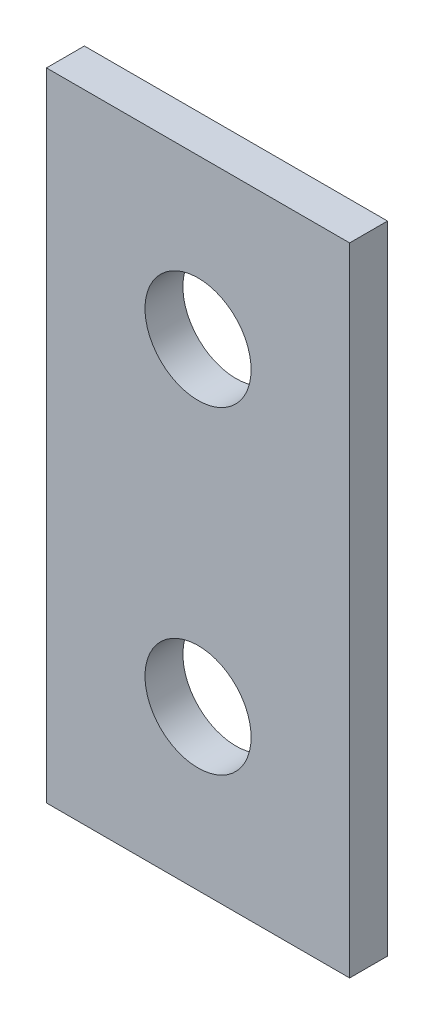
from build123d import *

# Parameters (mm, degrees)
CROQUIS4_W              = 40
CROQUIS4_H              = 84
SALIENTE_EXTRUIR3_DEPTH = 5
CROQUIS5_R              = 7
CORTAR_EXTRUIR1_DEPTH   = 5
CROQUIS5_3_R            = 7
CORTAR_EXTRUIR2_DEPTH   = 5


with BuildPart() as part:
    # Croquis4 → Saliente-Extruir3 (new body)
    with BuildSketch(Plane.XY):
        with Locations((20, 42)):
            Rectangle(CROQUIS4_W, CROQUIS4_H)
    extrude(amount=SALIENTE_EXTRUIR3_DEPTH)

    # Croquis5 → Cortar-Extruir1 (cut)
    with BuildSketch(Plane.XY.offset(5)):
        with Locations((20, 63)):
            Circle(CROQUIS5_R)
    extrude(amount=-CORTAR_EXTRUIR1_DEPTH, mode=Mode.SUBTRACT)

    # Croquis5<3> → Cortar-Extruir2 (cut)
    with BuildSketch(Plane.XY.offset(5)):
        with Locations((20, 21)):
            Circle(CROQUIS5_3_R)
    extrude(amount=-CORTAR_EXTRUIR2_DEPTH, mode=Mode.SUBTRACT)


solid = part.part
